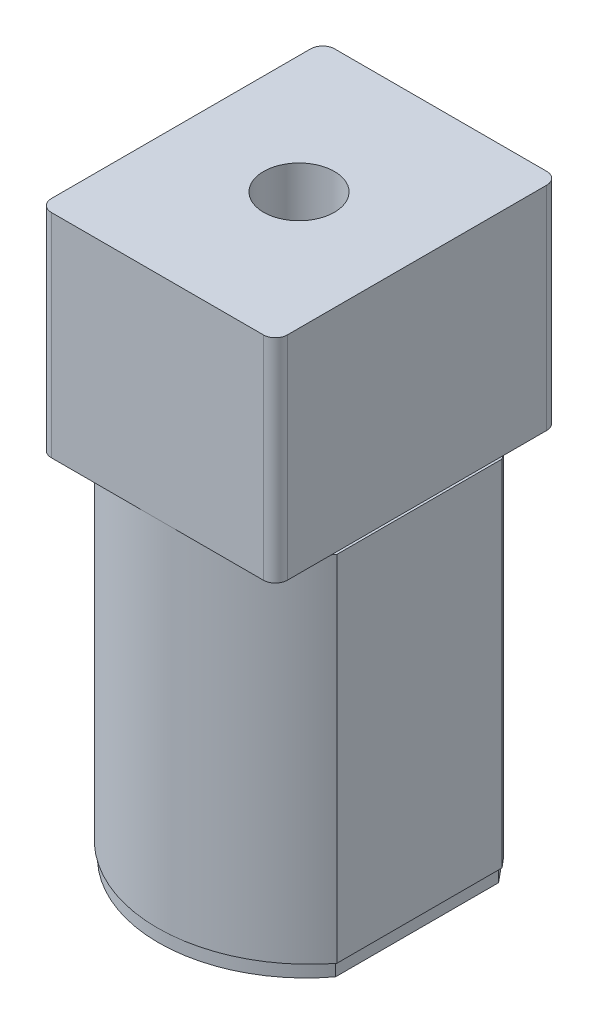
from build123d import *

# Parameters (mm, degrees)
SKETCH1_W           = 10.2
SKETCH1_H           = 7
BOSS_EXTRUDE1_DEPTH = 15
SKETCH2_W           = 10
SKETCH2_H           = 12
BOSS_EXTRUDE2_DEPTH = 9
FILLET1_R           = 0.508
SKETCH3_W           = 10
SKETCH3_H           = 6.9
BOSS_EXTRUDE3_DEPTH = 0.57
SKETCH4_R           = 1.5
CUT_EXTRUDE1_DEPTH  = 8.952


with BuildPart() as part:
    # Sketch1 → Boss-Extrude1 (new body)
    with BuildSketch(Plane(origin=(0, 0, 0), x_dir=(1, 0, 0), z_dir=(0, 1, 0))):
        with BuildLine():
            Line((-5.1, -3.5), (5.1, -3.5))
            ThreePointArc((5.1, -3.5), (0, -6), (-5.1, -3.5))
        make_face()
        Rectangle(SKETCH1_W, SKETCH1_H)
        with BuildLine():
            ThreePointArc((-5.1, 3.5), (0, 6), (5.1, 3.5))
            Line((5.1, 3.5), (-5.1, 3.5))
        make_face()
    extrude(amount=BOSS_EXTRUDE1_DEPTH)

    # Sketch2 → Boss-Extrude2 (add)
    with BuildSketch(Plane(origin=(0, 15, 0), x_dir=(1, 0, 0), z_dir=(0, 1, 0))):
        Rectangle(SKETCH2_W, SKETCH2_H)
    extrude(amount=BOSS_EXTRUDE2_DEPTH)

    # Fillet1
    fillet1_edges = [part.edges().sort_by_distance(p)[0] for p in [
        (5, 19.5, 6),
        (5, 19.5, -6),
        (-5, 19.5, -6),
        (-5, 19.5, 6),
    ]]
    fillet(fillet1_edges, radius=FILLET1_R)

    # Sketch3 → Boss-Extrude3 (add)
    with BuildSketch(Plane.XZ):
        Rectangle(SKETCH3_W, SKETCH3_H)
        with BuildLine():
            Line((5, -3.45), (-5, -3.45))
            ThreePointArc((-5, -3.45), (0, -5.95), (5, -3.45))
        make_face()
        with BuildLine():
            ThreePointArc((5, 3.45), (0, 5.95), (-5, 3.45))
            Line((-5, 3.45), (5, 3.45))
        make_face()
    extrude(amount=BOSS_EXTRUDE3_DEPTH)

    # Sketch4 → Cut-Extrude1 (cut)
    with BuildSketch(Plane(origin=(0, 24, 0), x_dir=(1, 0, 0), z_dir=(0, 1, 0))):
        with Locations(Location((0, 0, 0), (0, 0, 270))):
            Circle(SKETCH4_R)
    extrude(amount=-CUT_EXTRUDE1_DEPTH, mode=Mode.SUBTRACT)


solid = part.part
